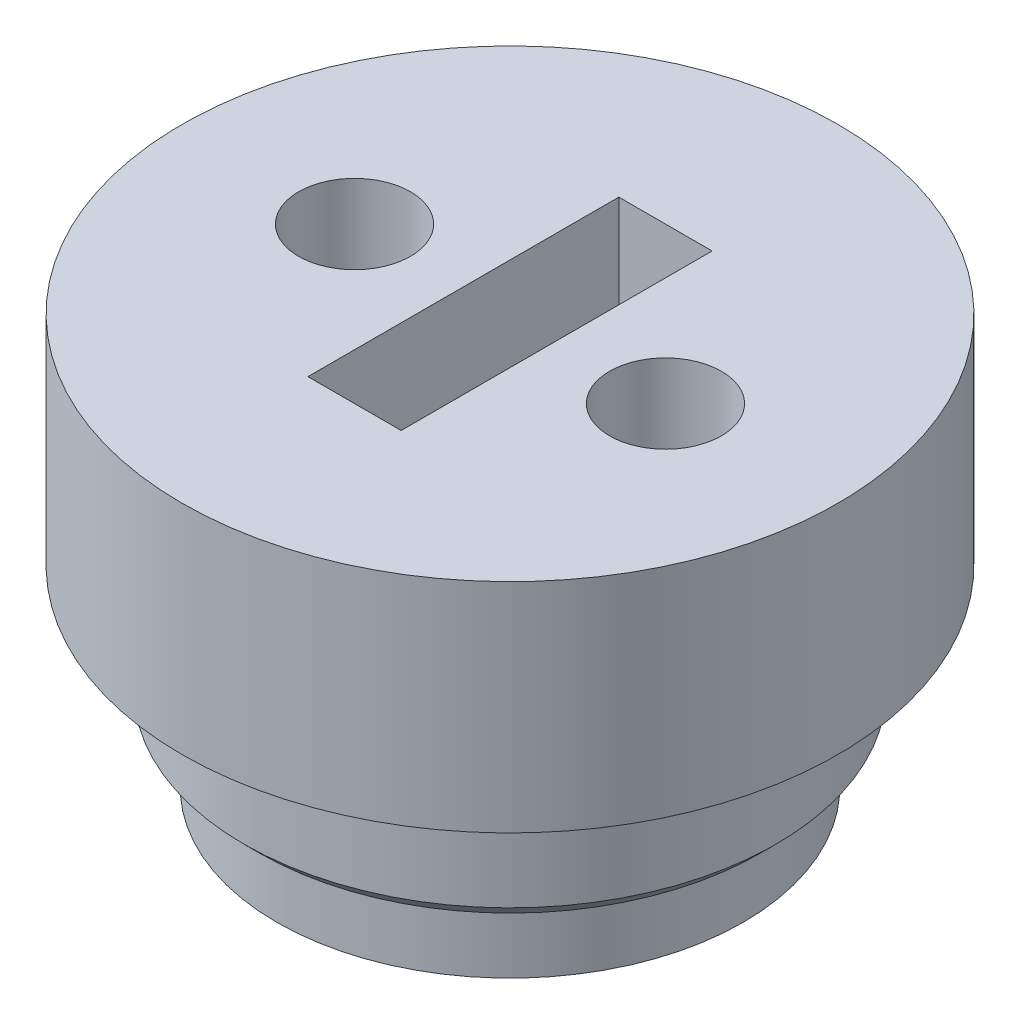
from build123d import *

# Parameters (mm, degrees)
SKIZZE1_R                       = 8.55
SKIZZE1_W                       = 3
SKIZZE1_H                       = 10
AUFSATZ_LINEAR_AUSTRAGEN1_DEPTH = 4
SKIZZE2_R                       = 10.55
SKIZZE2_W                       = 3
SKIZZE2_H                       = 10
AUFSATZ_LINEAR_AUSTRAGEN2_DEPTH = 7
SKIZZE3_R                       = 7.5
SKIZZE3_W                       = 3
SKIZZE3_H                       = 10
AUFSATZ_LINEAR_AUSTRAGEN3_DEPTH = 2.2
FASE1_SIZE                      = 0.5
SKIZZE4_R                       = 1.8
SCHNITT_LINEAR_AUSTRAGEN1_DEPTH = 10


with BuildPart() as part:
    # Skizze1 → Aufsatz-Linear austragen1 (new body)
    with BuildSketch(Plane(origin=(0, 0, 0), x_dir=(1, 0, 0), z_dir=(0, 1, 0))):
        with Locations(Location((0, 0, 0), (0, 0, 270))):
            Circle(SKIZZE1_R)
        Rectangle(SKIZZE1_W, SKIZZE1_H, mode=Mode.SUBTRACT)
    extrude(amount=AUFSATZ_LINEAR_AUSTRAGEN1_DEPTH)

    # Skizze2 → Aufsatz-Linear austragen2 (add)
    with BuildSketch(Plane(origin=(0, 4, 0), x_dir=(1, 0, 0), z_dir=(0, 1, 0))):
        with Locations(Location((0, 0, 0), (0, 0, 270))):
            Circle(SKIZZE2_R)
        Rectangle(SKIZZE2_W, SKIZZE2_H, mode=Mode.SUBTRACT)
    extrude(amount=AUFSATZ_LINEAR_AUSTRAGEN2_DEPTH)

    # Skizze3 → Aufsatz-Linear austragen3 (add)
    with BuildSketch(Plane.XZ):
        with Locations(Location((0, 0, 0), (0, 0, 270))):
            Circle(SKIZZE3_R)
        Rectangle(SKIZZE3_W, SKIZZE3_H, mode=Mode.SUBTRACT)
    extrude(amount=AUFSATZ_LINEAR_AUSTRAGEN3_DEPTH)

    # Fase1
    fase1_edges = [part.edges().sort_by_distance(p)[0] for p in [
        (0, 0, -8.55),
    ]]
    chamfer(fase1_edges, length=FASE1_SIZE)

    # Skizze4 → Schnitt-Linear austragen1 (cut)
    with BuildSketch(Plane.XZ.offset(-11)):
        with Locations(Location((-5, 0, 0), (0, 0, 270))):
            Circle(SKIZZE4_R)
        with Locations(Location((5, 0, 0), (0, 0, 270))):
            Circle(SKIZZE4_R)
    extrude(amount=SCHNITT_LINEAR_AUSTRAGEN1_DEPTH, mode=Mode.SUBTRACT)


solid = part.part
